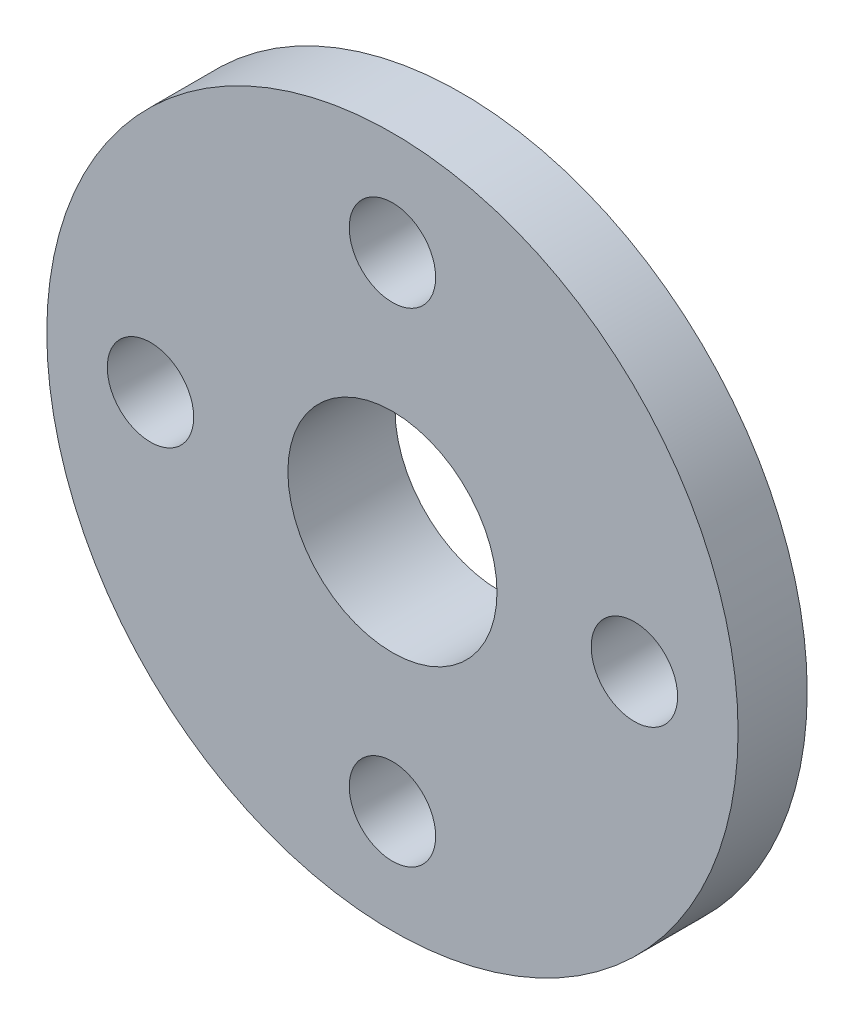
from build123d import *

# Parameters (mm, degrees)
SKETCH_1_W                  = 10
SKETCH_1_H                  = 2
SKETCH_2_R                  = 4.5
EXTRUDE_1_DEPTH             = 1.1
HOLE_WIZARD_1_D             = 6.05
HOLE_WIZARD_2_5_2_5_1_D     = 2.5
HOLE_WIZARD_2_5_2_5_1_DEPTH = 3.1


with BuildPart() as part:
    # 草图1 → 旋转1 (revolve)
    with BuildSketch(Plane(origin=(0, -19.899998127, 0), x_dir=(1, 0, 0), z_dir=(0, 1, 0))):
        with Locations((-34.10264652, -10.476)):
            Rectangle(SKETCH_1_W, SKETCH_1_H)
    revolve(axis=Axis((-39.10264652, -19.899998127, 9.476), (0, 0, 1)))

    # 草图2 → 凸台-拉伸1 (add)
    with BuildSketch(Plane(origin=(0, 0, 9.476), x_dir=(-1, 0, 0), z_dir=(0, 0, -1))):
        with Locations((39.10264652, -19.899998127)):
            Circle(SKETCH_2_R)
    extrude(amount=EXTRUDE_1_DEPTH)

    # 孔1 (through all)
    with Locations(Plane.XY.offset(11.476)):
        with Locations((-39.10264652, -19.899998127)):
            Hole(HOLE_WIZARD_1_D / 2)

    # Ø2.5 (2.5) 直径孔1
    with Locations(Plane.XY.offset(11.476)):
        with Locations((-46.102644647, -19.899998127), (-39.10264652, -26.899996254), (-32.102648393, -19.899998127), (-39.10264652, -12.9)):
            Hole(HOLE_WIZARD_2_5_2_5_1_D / 2, depth=HOLE_WIZARD_2_5_2_5_1_DEPTH)


solid = part.part
